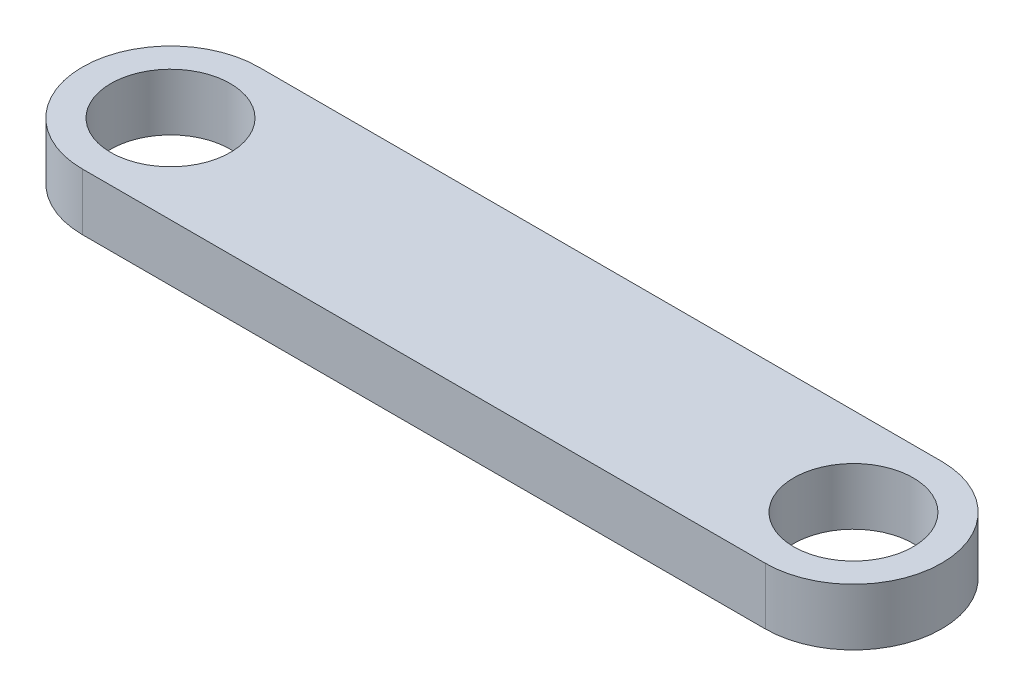
from build123d import *

# Parameters (mm, degrees)
SKETCH1_R           = 2.667
BOSS_EXTRUDE1_DEPTH = 2.54


with BuildPart() as part:
    # Sketch1 → Boss-Extrude1 (new body)
    with BuildSketch(Plane(origin=(0, 0, 0), x_dir=(1, 0, 0), z_dir=(0, 1, 0))):
        with BuildLine():
            Line((0, 3.937), (30.48, 3.937))
            ThreePointArc((30.48, 3.937), (34.417, 0), (30.48, -3.937))
            Line((30.48, -3.937), (0, -3.937))
            ThreePointArc((0, -3.937), (-3.937, 0), (0, 3.937))
        make_face()
        with Locations(Location((0, 0, 0), (0, 0, 270))):
            Circle(SKETCH1_R, mode=Mode.SUBTRACT)
        with Locations(Location((30.48, 0, 0), (0, 0, 270))):
            Circle(SKETCH1_R, mode=Mode.SUBTRACT)
    extrude(amount=BOSS_EXTRUDE1_DEPTH)


solid = part.part
